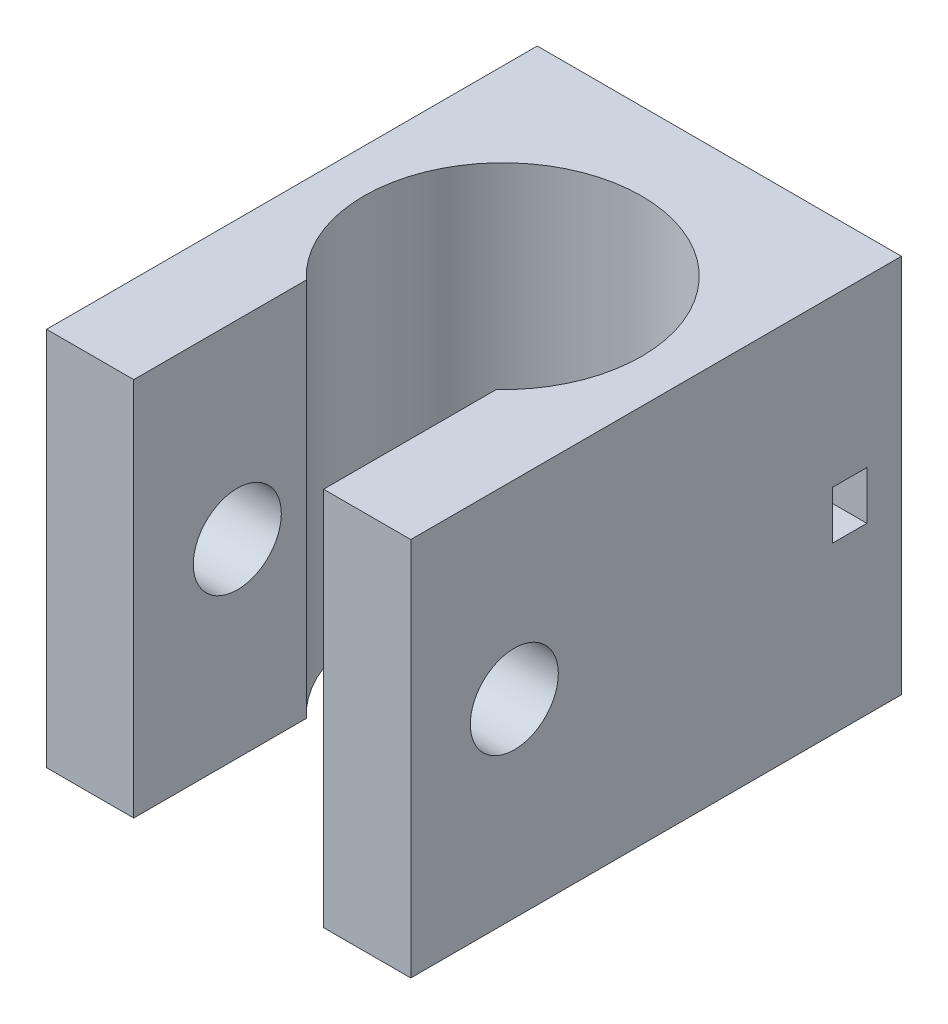
from build123d import *

# Parameters (mm, degrees)
BOSS_EXTRUDE1_DEPTH = 11
CUT_EXTRUDE1_REACH  = 30.128
SKETCH2_R           = 2.55
SKETCH4_W           = 2
SKETCH4_H           = 2.8
CUT_EXTRUDE3_DEPTH  = 21.1
SKETCH5_W           = 4.9
SKETCH5_H           = 4.9
BOSS_EXTRUDE2_DEPTH = 2


with BuildPart() as part:
    # Sketch1 → Boss-Extrude1 (new, symmetric)
    with BuildSketch(Plane(origin=(0, 0, 0), x_dir=(1, 0, 0), z_dir=(0, 1, 0))):
        with BuildLine():
            Line((-5.5, -15), (-10.55, -15))
            Line((-10.55, -15), (-10.55, 13.42813746))
            Line((-10.55, 13.42813746), (10.55, 13.42813746))
            Line((10.55, 13.42813746), (10.55, -15))
            Line((10.55, -15), (5.5, -15))
            Line((5.5, -15), (5.5, -5))
            ThreePointArc((5.5, -5), (0, 8.92813746), (-5.5, -5))
            Line((-5.5, -5), (-5.5, -15))
        make_face()
    extrude(amount=BOSS_EXTRUDE1_DEPTH, both=True)

    # Cut-Extrude1: up to this face of the body (flat: up to its plane)
    cut_extrude1_end = Plane(part.part.faces().sort_by_distance((-10.55, 0, 0.78593127))[0])
    # Sketch2 → Cut-Extrude1 (cut, up to the picked face)
    with BuildSketch(Plane(origin=(10.55, 0, 0), x_dir=(0, 0, -1), z_dir=(1, 0, 0)), mode=Mode.PRIVATE) as cut_extrude1_sk1:
        with Locations((-9, 0)):
            Circle(SKETCH2_R)
    cut_extrude1_tool1 = split(extrude(cut_extrude1_sk1.sketch, amount=-CUT_EXTRUDE1_REACH, mode=Mode.PRIVATE), bisect_by=cut_extrude1_end, keep=Keep.BOTH, mode=Mode.PRIVATE)
    add(cut_extrude1_tool1.solids().sort_by(Axis((10.55, 0, 9), (-1, 0, 0)))[0], mode=Mode.SUBTRACT)

    # Sketch4 → Cut-Extrude3 (cut)
    with BuildSketch(Plane(origin=(10.55, 0, 0), x_dir=(0, 0, -1), z_dir=(1, 0, 0))):
        with Locations((10.42813746, 0)):
            Rectangle(SKETCH4_W, SKETCH4_H)
    extrude(amount=-CUT_EXTRUDE3_DEPTH, mode=Mode.SUBTRACT)

    # Sketch5 → Boss-Extrude2 (add)
    with BuildSketch(Plane(origin=(0, 0, -13.42813746), x_dir=(-1, 0, 0), z_dir=(0, 0, -1))):
        with Locations((0.05, 6.1)):
            Rectangle(SKETCH5_W, SKETCH5_H)
        with Locations((0.05, -6.1)):
            Rectangle(SKETCH5_W, SKETCH5_H)
    extrude(amount=BOSS_EXTRUDE2_DEPTH)


solid = part.part
